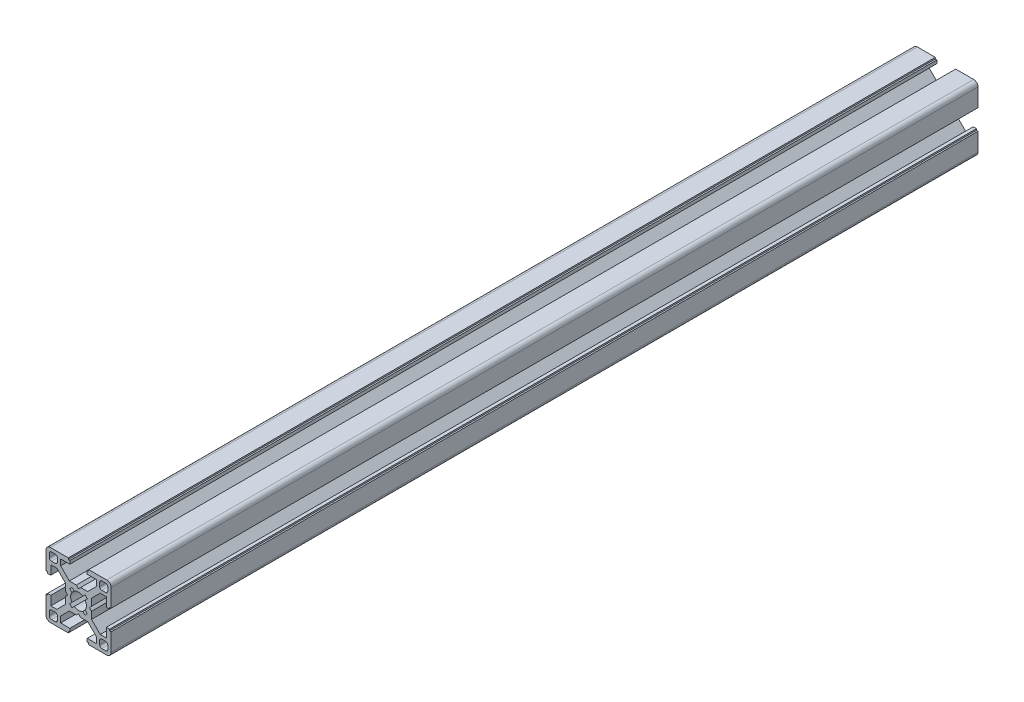
from build123d import *

# Parameters (mm, degrees)
ESTRUSIONE_ESTRUSIONE2_DEPTH = 400


with BuildPart() as part:
    # Schizzo1 → Estrusione-Estrusione2 (new body)
    with BuildSketch(Plane.XY):
        with BuildLine():
            Line((-15, 13), (-15, 4.7))
            Line((-15, 4.7), (-14.3, 4.7))
            Line((-14.3, 4.7), (-14.3, 4))
            Line((-14.3, 4), (-12.8, 4))
            Line((-12.8, 4), (-12.8, 8.25))
            Line((-12.8, 8.25), (-10.017766953, 8.25))
            Line((-10.017766953, 8.25), (-6, 4.232233047))
            Line((-6, 4.232233047), (-6, 1))
            Line((-6, 1), (-5, 0))
            Line((-5, 0), (-6, -1))
            Line((-6, -1), (-6, -4.232233047))
            Line((-6, -4.232233047), (-10.017766953, -8.25))
            Line((-10.017766953, -8.25), (-12.8, -8.25))
            Line((-12.8, -8.25), (-12.8, -4))
            Line((-12.8, -4), (-14.3, -4))
            Line((-14.3, -4), (-14.3, -4.7))
            Line((-14.3, -4.7), (-15, -4.7))
            Line((-15, -4.7), (-15, -13))
            ThreePointArc((-15, -13), (-14.414213562, -14.414213562), (-13, -15))
            Line((-13, -15), (-4.7, -15))
            Line((-4.7, -15), (-4.7, -14.3))
            Line((-4.7, -14.3), (-4, -14.3))
            Line((-4, -14.3), (-4, -12.8))
            Line((-4, -12.8), (-8.25, -12.8))
            Line((-8.25, -12.8), (-8.25, -10.017766953))
            Line((-8.25, -10.017766953), (-4.232233047, -6))
            Line((-4.232233047, -6), (-1, -6))
            Line((-1, -6), (0, -5))
            Line((0, -5), (1, -6))
            Line((1, -6), (4.232233047, -6))
            Line((4.232233047, -6), (8.25, -10.017766953))
            Line((8.25, -10.017766953), (8.25, -12.8))
            Line((8.25, -12.8), (4, -12.8))
            Line((4, -12.8), (4, -14.3))
            Line((4, -14.3), (4.7, -14.3))
            Line((4.7, -14.3), (4.7, -15))
            Line((4.7, -15), (13, -15))
            ThreePointArc((13, -15), (14.414213562, -14.414213562), (15, -13))
            Line((15, -13), (15, -4.7))
            Line((15, -4.7), (14.3, -4.7))
            Line((14.3, -4.7), (14.3, -4))
            Line((14.3, -4), (12.8, -4))
            Line((12.8, -4), (12.8, -8.25))
            Line((12.8, -8.25), (10.017766953, -8.25))
            Line((10.017766953, -8.25), (6, -4.232233047))
            Line((6, -4.232233047), (6, -1))
            Line((6, -1), (5, 0))
            Line((5, 0), (6, 1))
            Line((6, 1), (6, 4.232233047))
            Line((6, 4.232233047), (10.017766953, 8.25))
            Line((10.017766953, 8.25), (12.8, 8.25))
            Line((12.8, 8.25), (12.8, 4))
            Line((12.8, 4), (14.3, 4))
            Line((14.3, 4), (14.3, 4.7))
            Line((14.3, 4.7), (15, 4.7))
            Line((15, 4.7), (15, 13))
            ThreePointArc((15, 13), (14.414213562, 14.414213562), (13, 15))
            Line((13, 15), (4.7, 15))
            Line((4.7, 15), (4.7, 14.3))
            Line((4.7, 14.3), (4, 14.3))
            Line((4, 14.3), (4, 12.8))
            Line((4, 12.8), (8.25, 12.8))
            Line((8.25, 12.8), (8.25, 10.017766953))
            Line((8.25, 10.017766953), (4.232233047, 6))
            Line((4.232233047, 6), (1, 6))
            Line((1, 6), (0, 5))
            Line((0, 5), (-1, 6))
            Line((-1, 6), (-4.232233047, 6))
            Line((-4.232233047, 6), (-8.25, 10.017766953))
            Line((-8.25, 10.017766953), (-8.25, 12.8))
            Line((-8.25, 12.8), (-4, 12.8))
            Line((-4, 12.8), (-4, 14.3))
            Line((-4, 14.3), (-4.7, 14.3))
            Line((-4.7, 14.3), (-4.7, 15))
            Line((-4.7, 15), (-13, 15))
            ThreePointArc((-13, 15), (-14.414213562, 14.414213562), (-15, 13))
        make_face()
        with BuildLine():
            Line((13.5, 10.75), (13.5, 12.5))
            ThreePointArc((13.5, 12.5), (13.207106781, 13.207106781), (12.5, 13.5))
            Line((12.5, 13.5), (10.75, 13.5))
            ThreePointArc((10.75, 13.5), (10.042893219, 13.207106781), (9.75, 12.5))
            Line((9.75, 12.5), (9.75, 10.75))
            ThreePointArc((9.75, 10.75), (10.042893219, 10.042893219), (10.75, 9.75))
            Line((10.75, 9.75), (12.5, 9.75))
            ThreePointArc((12.5, 9.75), (13.207106781, 10.042893219), (13.5, 10.75))
        make_face(mode=Mode.SUBTRACT)
        with BuildLine():
            Line((10.75, -13.5), (12.5, -13.5))
            ThreePointArc((12.5, -13.5), (13.207106781, -13.207106781), (13.5, -12.5))
            Line((13.5, -12.5), (13.5, -10.75))
            ThreePointArc((13.5, -10.75), (13.207106781, -10.042893219), (12.5, -9.75))
            Line((12.5, -9.75), (10.75, -9.75))
            ThreePointArc((10.75, -9.75), (10.042893219, -10.042893219), (9.75, -10.75))
            Line((9.75, -10.75), (9.75, -12.5))
            ThreePointArc((9.75, -12.5), (10.042893219, -13.207106781), (10.75, -13.5))
        make_face(mode=Mode.SUBTRACT)
        with BuildLine():
            Line((-13.5, -10.75), (-13.5, -12.5))
            ThreePointArc((-13.5, -12.5), (-13.207106781, -13.207106781), (-12.5, -13.5))
            Line((-12.5, -13.5), (-10.75, -13.5))
            ThreePointArc((-10.75, -13.5), (-10.042893219, -13.207106781), (-9.75, -12.5))
            Line((-9.75, -12.5), (-9.75, -10.75))
            ThreePointArc((-9.75, -10.75), (-10.042893219, -10.042893219), (-10.75, -9.75))
            Line((-10.75, -9.75), (-12.5, -9.75))
            ThreePointArc((-12.5, -9.75), (-13.207106781, -10.042893219), (-13.5, -10.75))
        make_face(mode=Mode.SUBTRACT)
        with BuildLine():
            Line((1.995536102, 3.056196274), (3.00520382, 4.065863992))
            Line((3.00520382, 4.065863992), (4.065863992, 3.00520382))
            Line((4.065863992, 3.00520382), (3.056196274, 1.995536102))
            ThreePointArc((3.056196274, 1.995536102), (3.498400806, 1.041005187), (3.65, 0))
            ThreePointArc((3.65, 0), (3.498400806, -1.041005187), (3.056196274, -1.995536102))
            Line((3.056196274, -1.995536102), (4.065863992, -3.00520382))
            Line((4.065863992, -3.00520382), (3.00520382, -4.065863992))
            Line((3.00520382, -4.065863992), (1.995536102, -3.056196274))
            ThreePointArc((1.995536102, -3.056196274), (1.041005187, -3.498400806), (0, -3.65))
            ThreePointArc((0, -3.65), (-1.041005187, -3.498400806), (-1.995536102, -3.056196274))
            Line((-1.995536102, -3.056196274), (-3.00520382, -4.065863992))
            Line((-3.00520382, -4.065863992), (-4.065863992, -3.00520382))
            Line((-4.065863992, -3.00520382), (-3.056196274, -1.995536102))
            ThreePointArc((-3.056196274, -1.995536102), (-3.498400806, -1.041005187), (-3.65, 0))
            ThreePointArc((-3.65, 0), (-3.498400806, 1.041005187), (-3.056196274, 1.995536102))
            Line((-3.056196274, 1.995536102), (-4.065863992, 3.00520382))
            Line((-4.065863992, 3.00520382), (-3.00520382, 4.065863992))
            Line((-3.00520382, 4.065863992), (-1.995536102, 3.056196274))
            ThreePointArc((-1.995536102, 3.056196274), (-1.041005187, 3.498400806), (0, 3.65))
            ThreePointArc((0, 3.65), (1.041005187, 3.498400806), (1.995536102, 3.056196274))
        make_face(mode=Mode.SUBTRACT)
        with BuildLine():
            Line((-10.75, 9.75), (-12.5, 9.75))
            ThreePointArc((-12.5, 9.75), (-13.207106781, 10.042893219), (-13.5, 10.75))
            Line((-13.5, 10.75), (-13.5, 12.5))
            ThreePointArc((-13.5, 12.5), (-13.207106781, 13.207106781), (-12.5, 13.5))
            Line((-12.5, 13.5), (-10.75, 13.5))
            ThreePointArc((-10.75, 13.5), (-10.042893219, 13.207106781), (-9.75, 12.5))
            Line((-9.75, 12.5), (-9.75, 10.75))
            ThreePointArc((-9.75, 10.75), (-10.042893219, 10.042893219), (-10.75, 9.75))
        make_face(mode=Mode.SUBTRACT)
    extrude(amount=ESTRUSIONE_ESTRUSIONE2_DEPTH)


solid = part.part
